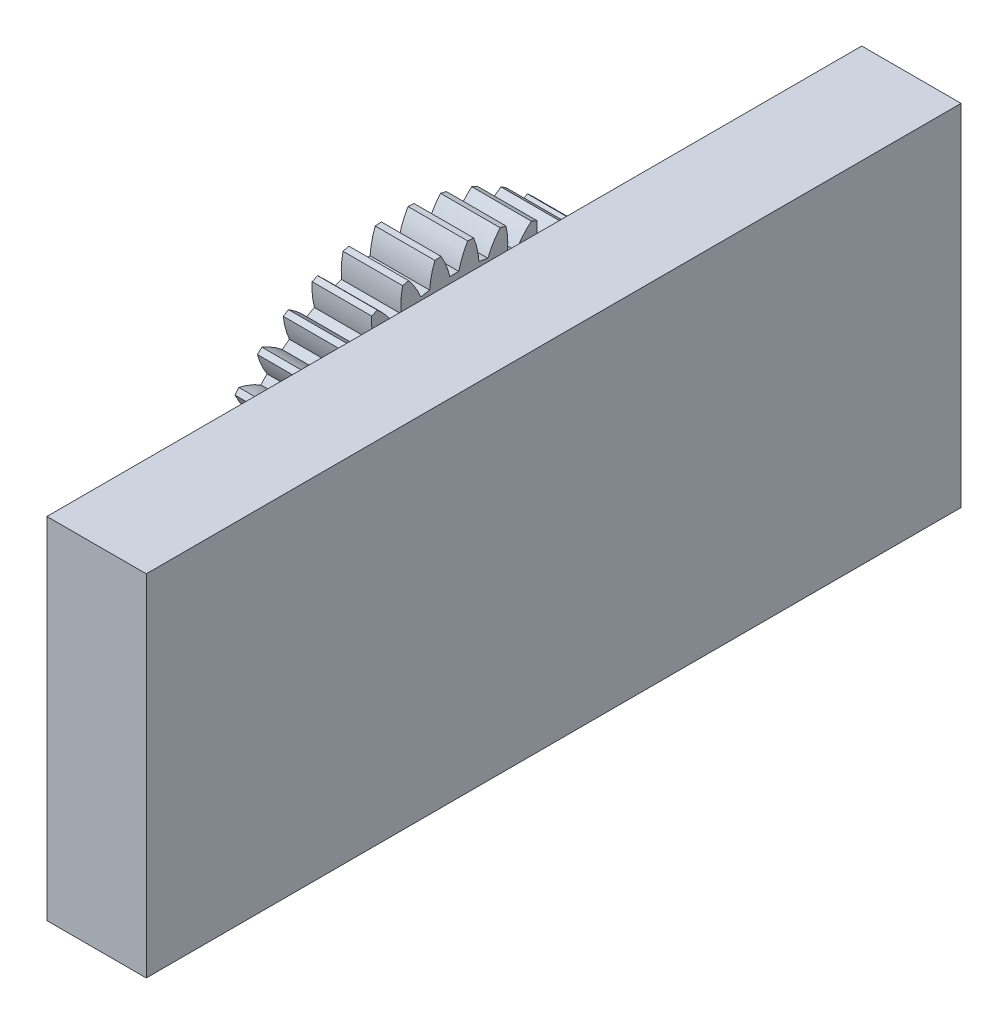
from build123d import *

# Parameters (mm, degrees)
BASPROSKE_W         = 6
BASPROSKE_H         = 20.5
TOOTHCUT_DEPTH      = 30.605742686
TEETHCUTS_COUNT     = 39
TEETHCUTS_ANGLE     = 350.769230769
BORSKE_R            = 11
BORE_DEPTH          = 50.0000508
SKETCH1_W           = 82.010805134
SKETCH1_H           = 35.231205716
BOSS_EXTRUDE1_DEPTH = 10


with BuildPart() as part:
    # BasProSke → Base-Revolve (revolve)
    with BuildSketch(Plane(origin=(0, 0, 0), x_dir=(1, 0, 0), z_dir=(0, 1, 0)), mode=Mode.PRIVATE) as base_revolve_sk:
        with Locations((3, 10.25)):
            Rectangle(BASPROSKE_W, BASPROSKE_H)
    revolve(base_revolve_sk.sketch.rotate(Axis((-10, 0, 0), (1, 0, 0)), 180), axis=Axis((-10, 0, 0), (1, 0, 0)))

    # TooCutSke → ToothCut (cut, through all)
    with BuildSketch(Plane(origin=(0, 0, 0), x_dir=(0, 0, -1), z_dir=(1, 0, 0))):
        with BuildLine():
            ThreePointArc((0.450063598, 18.243449338), (0, 18.249), (-0.450063598, 18.243449338))
            ThreePointArc((-0.450063598, 18.243449338), (-0.816963734, 19.397278425), (-1.358007102, 20.480426311))
            ThreePointArc((-1.358007102, 20.480426311), (0, 20.5254), (1.358007102, 20.480426311))
            ThreePointArc((1.358007102, 20.480426311), (0.816963734, 19.397278425), (0.450063598, 18.243449338))
        make_face()
    toothcut = extrude(amount=TOOTHCUT_DEPTH, mode=Mode.SUBTRACT)

    # TeethCuts: ToothCut ×39 about axis
    teethcuts_axis = Axis((-10, 0, 0), (1, 0, 0))
    for i in range(1, TEETHCUTS_COUNT):
        add(toothcut.rotate(teethcuts_axis, i * TEETHCUTS_ANGLE / (TEETHCUTS_COUNT - 1)), mode=Mode.SUBTRACT)

    # BorSke → Bore (cut, symmetric)
    with BuildSketch(Plane(origin=(0, 0, 0), x_dir=(0, 0, -1), z_dir=(1, 0, 0))):
        with Locations(Location((0, 0, 0), (0, 0, 180))):
            Circle(BORSKE_R)
    extrude(amount=BORE_DEPTH, both=True, mode=Mode.SUBTRACT)

    # Sketch1 → Boss-Extrude1 (add)
    with BuildSketch(Plane(origin=(6, 0, 0), x_dir=(0, 0, -1), z_dir=(1, 0, 0))):
        Rectangle(SKETCH1_W, SKETCH1_H)
    extrude(amount=BOSS_EXTRUDE1_DEPTH)


solid = part.part
